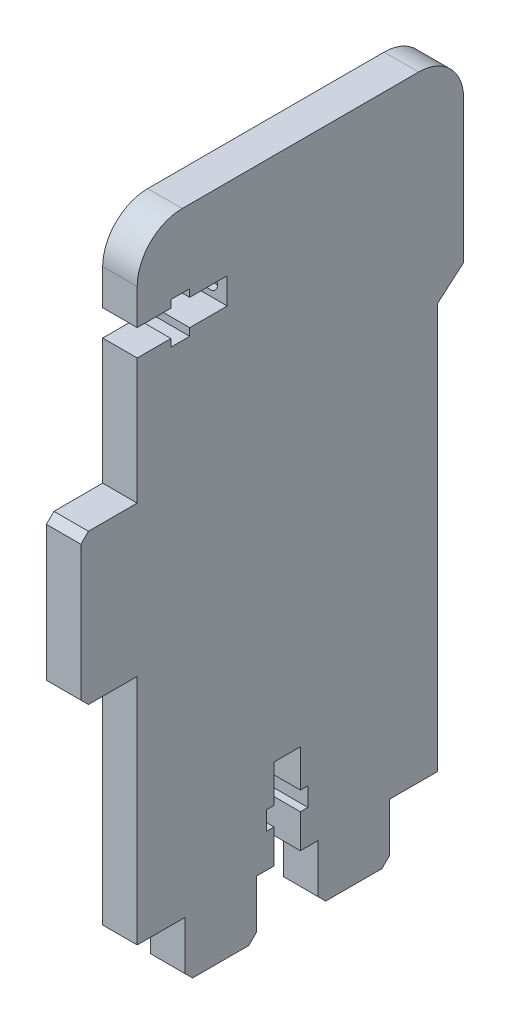
from build123d import *

# Parameters (mm, degrees)
EXTRUDE1_DEPTH = 4.6
SKETCH2_R      = 1
EXTRUDE2_DEPTH = 1
SKETCH3_R      = 1
EXTRUDE3_DEPTH = 1


with BuildPart() as part:
    # Sketch1 → Extrude1 (new body)
    with BuildSketch(Plane(origin=(0, 0, 0), x_dir=(0, 0, -1), z_dir=(1, 0, 0))):
        with BuildLine():
            Line((28.351631804, 12.38738065), (28.351631804, 5.88738065))
            Line((28.351631804, 5.88738065), (27.351631804, 4.88738065))
            Line((27.351631804, 4.88738065), (19.851631804, 4.88738065))
            Line((19.851631804, 4.88738065), (18.851631804, 5.88738065))
            Line((18.851631804, 5.88738065), (18.851631804, 12.38738065))
            Line((18.851631804, 12.38738065), (12.476631804, 12.38738065))
            Line((12.476631804, 12.38738065), (12.476631804, 43.38738065))
            Line((12.476631804, 43.38738065), (5.976631804, 43.38738065))
            Line((5.976631804, 43.38738065), (4.976631804, 44.38738065))
            Line((4.976631804, 44.38738065), (4.976631804, 62.38738065))
            Line((4.976631804, 62.38738065), (5.976631804, 63.38738065))
            Line((5.976631804, 63.38738065), (12.476631804, 63.38738065))
            Line((12.476631804, 63.38738065), (12.476631804, 80.13738065))
            Line((12.476631804, 80.13738065), (16.976631804, 80.13738065))
            Line((16.976631804, 80.13738065), (16.976631804, 79.13738065))
            Line((16.976631804, 79.13738065), (19.476631804, 79.13738065))
            Line((19.476631804, 79.13738065), (19.476631804, 80.13738065))
            Line((19.476631804, 80.13738065), (24.476631804, 80.13738065))
            Line((24.476631804, 80.13738065), (24.476631804, 83.63738065))
            Line((24.476631804, 83.63738065), (19.476631804, 83.63738065))
            Line((19.476631804, 83.63738065), (19.476631804, 84.63738065))
            Line((19.476631804, 84.63738065), (16.976631804, 84.63738065))
            Line((16.976631804, 84.63738065), (16.976631804, 83.63738065))
            Line((16.976631804, 83.63738065), (12.476631804, 83.63738065))
            Line((12.476631804, 83.63738065), (12.476631804, 88.38738065))
            ThreePointArc((12.476631804, 88.38738065), (14.233991117, 92.630021337), (18.476631804, 94.38738065))
            Line((18.476631804, 94.38738065), (49.976631804, 94.38738065))
            ThreePointArc((49.976631804, 94.38738065), (54.219272491, 92.630021337), (55.976631804, 88.38738065))
            Line((55.976631804, 88.38738065), (55.976631804, 69.38738065))
            Line((55.976631804, 69.38738065), (52.476631804, 66.38738065))
            Line((52.476631804, 66.38738065), (52.476631804, 12.38738065))
            Line((52.476631804, 12.38738065), (46.101631804, 12.38738065))
            Line((46.101631804, 12.38738065), (46.101631804, 5.88738065))
            Line((46.101631804, 5.88738065), (45.101631804, 4.88738065))
            Line((45.101631804, 4.88738065), (37.601631804, 4.88738065))
            Line((37.601631804, 4.88738065), (36.601631804, 5.88738065))
            Line((36.601631804, 5.88738065), (36.601631804, 12.38738065))
            Line((36.601631804, 12.38738065), (34.226631804, 12.38738065))
            Line((34.226631804, 12.38738065), (34.226631804, 16.88738065))
            Line((34.226631804, 16.88738065), (35.226631804, 16.88738065))
            Line((35.226631804, 16.88738065), (35.226631804, 19.38738065))
            Line((35.226631804, 19.38738065), (34.226631804, 19.38738065))
            Line((34.226631804, 19.38738065), (34.226631804, 24.38738065))
            Line((34.226631804, 24.38738065), (30.726631804, 24.38738065))
            Line((30.726631804, 24.38738065), (30.726631804, 19.38738065))
            Line((30.726631804, 19.38738065), (29.726631804, 19.38738065))
            Line((29.726631804, 19.38738065), (29.726631804, 16.88738065))
            Line((29.726631804, 16.88738065), (30.726631804, 16.88738065))
            Line((30.726631804, 16.88738065), (30.726631804, 12.38738065))
            Line((30.726631804, 12.38738065), (28.351631804, 12.38738065))
        make_face()
    extrude(amount=EXTRUDE1_DEPTH)

    # Sketch2 → Extrude2 (cut)
    with BuildSketch(Plane.XY.offset(-24.476631804)):
        with Locations((2.3, 81.88738065)):
            Circle(SKETCH2_R)
    extrude(amount=-EXTRUDE2_DEPTH, mode=Mode.SUBTRACT)

    # Sketch3 → Extrude3 (cut)
    with BuildSketch(Plane.XZ.offset(-24.38738065)):
        with Locations(Location((2.3, -32.476631804, 0), (0, 0, 270))):
            Circle(SKETCH3_R)
    extrude(amount=-EXTRUDE3_DEPTH, mode=Mode.SUBTRACT)


solid = part.part
